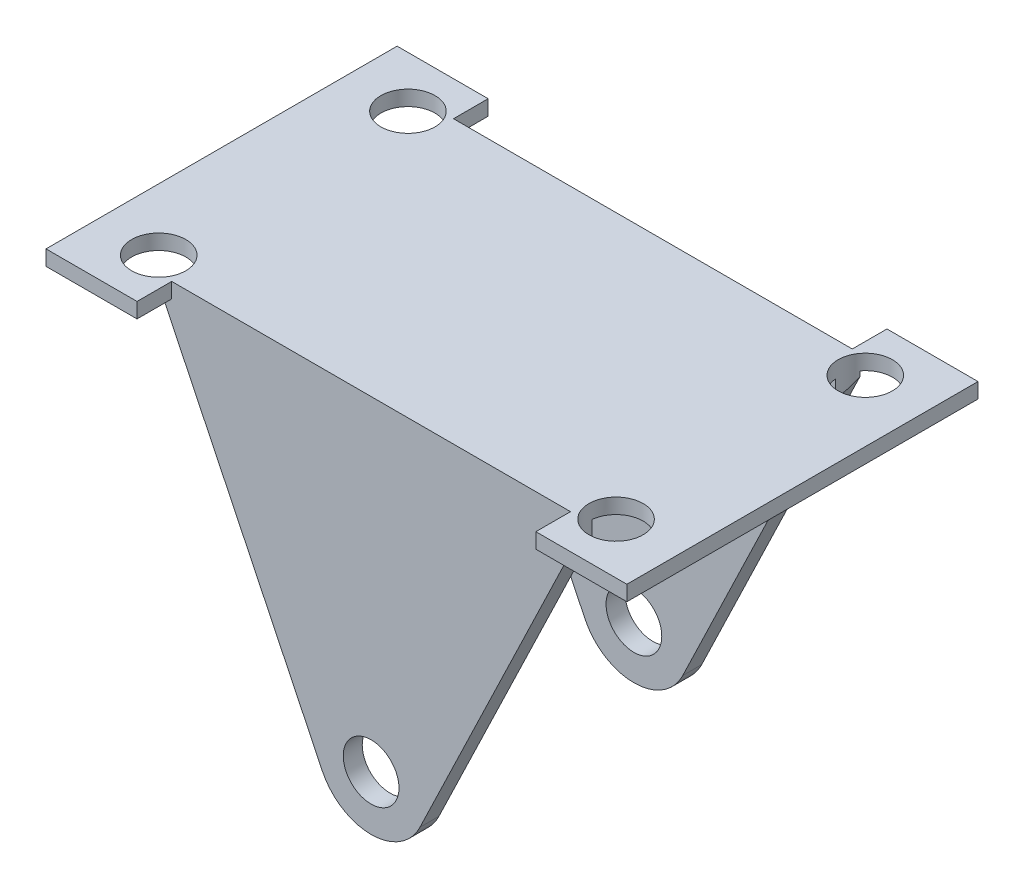
from build123d import *

# Parameters (mm, degrees)
BOSS_EXTRUDE1_DEPTH         = 16.51
BOSS_EXTRUDE2_DEPTH         = 1.778
F_1_4_0_25_DIAMETER_HOLE1_D = 6.35
SKETCH6_W                   = 53.975
SKETCH6_H                   = 44.45
CUT_EXTRUDE1_DEPTH          = 14.2875
F_0_257_DIAMETER_HOLE1_D    = 6.5278


with BuildPart() as part:
    # Sketch1 → Boss-Extrude1 (new, symmetric)
    with BuildSketch(Plane.XY):
        with BuildLine():
            Line((25.4, 19.05), (-25.4, 19.05))
            Line((-25.4, 19.05), (-5.720931214, -21.805620809))
            ThreePointArc((-5.720931214, -21.805620809), (0, -25.4), (5.720931214, -21.805620809))
            Line((5.720931214, -21.805620809), (25.4, 19.05))
        make_face()
    extrude(amount=BOSS_EXTRUDE1_DEPTH, both=True)

    # Sketch2 → Boss-Extrude2 (add)
    with BuildSketch(Plane(origin=(0, 19.05, 0), x_dir=(1, 0, 0), z_dir=(0, 1, 0))):
        Polygon((-34.036, -20.574), (-34.036, 20.574), (-23.368, 20.574), (-23.368, 16.51), (23.368, 16.51), (23.368, 20.574), (34.036, 20.574), (34.036, -20.574), (23.368, -20.574), (23.368, -16.51), (-23.368, -16.51), (-23.368, -20.574), align=None)
    extrude(amount=-BOSS_EXTRUDE2_DEPTH)

    # 1/4 (0.25) Diameter Hole1 (through all)
    with Locations(Plane(origin=(0, 19.05, 0), x_dir=(1, 0, 0), z_dir=(0, 1, 0))):
        with Locations((-26.797, 14.603831543), (-26.797, -14.603831543), (26.797, -14.603831543), (26.797, 14.603831543)):
            Hole(F_1_4_0_25_DIAMETER_HOLE1_D / 2)

    # Sketch6 → Cut-Extrude1 (cut, symmetric)
    with BuildSketch(Plane.XY):
        with Locations((0, -4.953)):
            Rectangle(SKETCH6_W, SKETCH6_H)
    extrude(amount=CUT_EXTRUDE1_DEPTH, both=True, mode=Mode.SUBTRACT)

    # F (0.257) Diameter Hole1 (through all)
    with Locations(Plane.XY.offset(16.51)):
        with Locations((0, -19.05)):
            Hole(F_0_257_DIAMETER_HOLE1_D / 2)


solid = part.part
